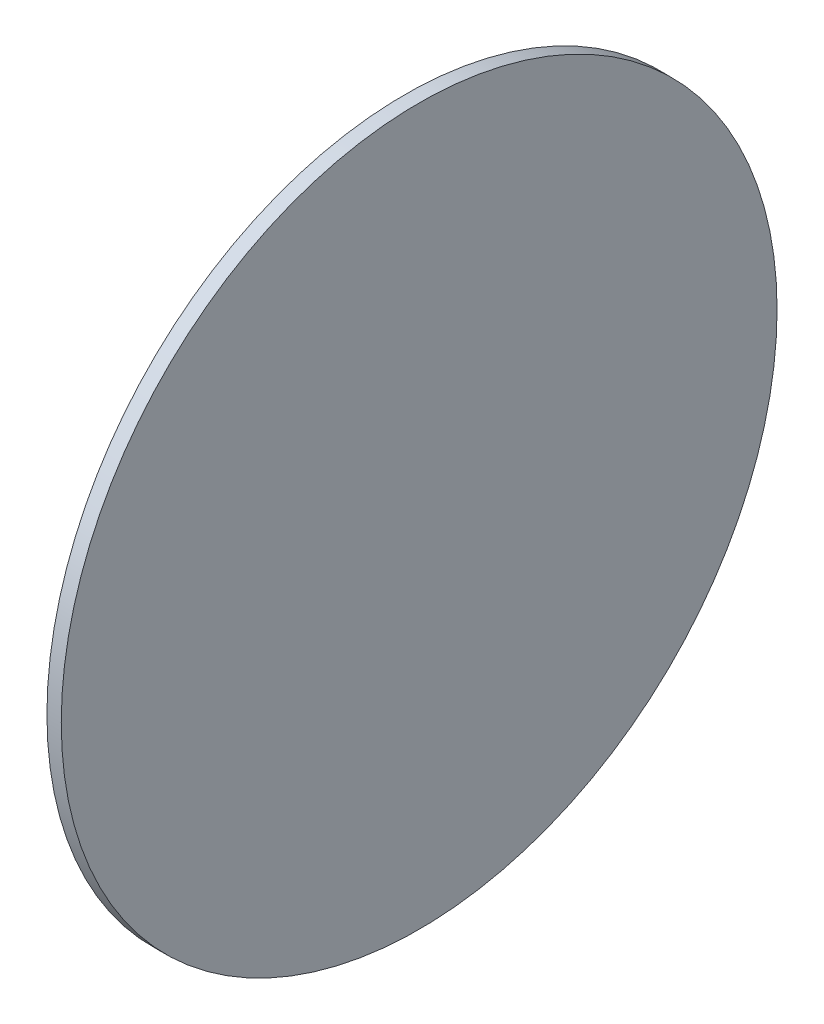
from build123d import *

# Parameters (mm, degrees)
ESQUISSE2_R        = 500
BOSS_EXTRU_2_DEPTH = 20


with BuildPart() as part:
    # Esquisse2 → Boss.-Extru.2 (new body)
    with BuildSketch(Plane(origin=(0, 0, 0), x_dir=(0, 0, -1), z_dir=(1, 0, 0))):
        Circle(ESQUISSE2_R)
    extrude(amount=BOSS_EXTRU_2_DEPTH)


solid = part.part
